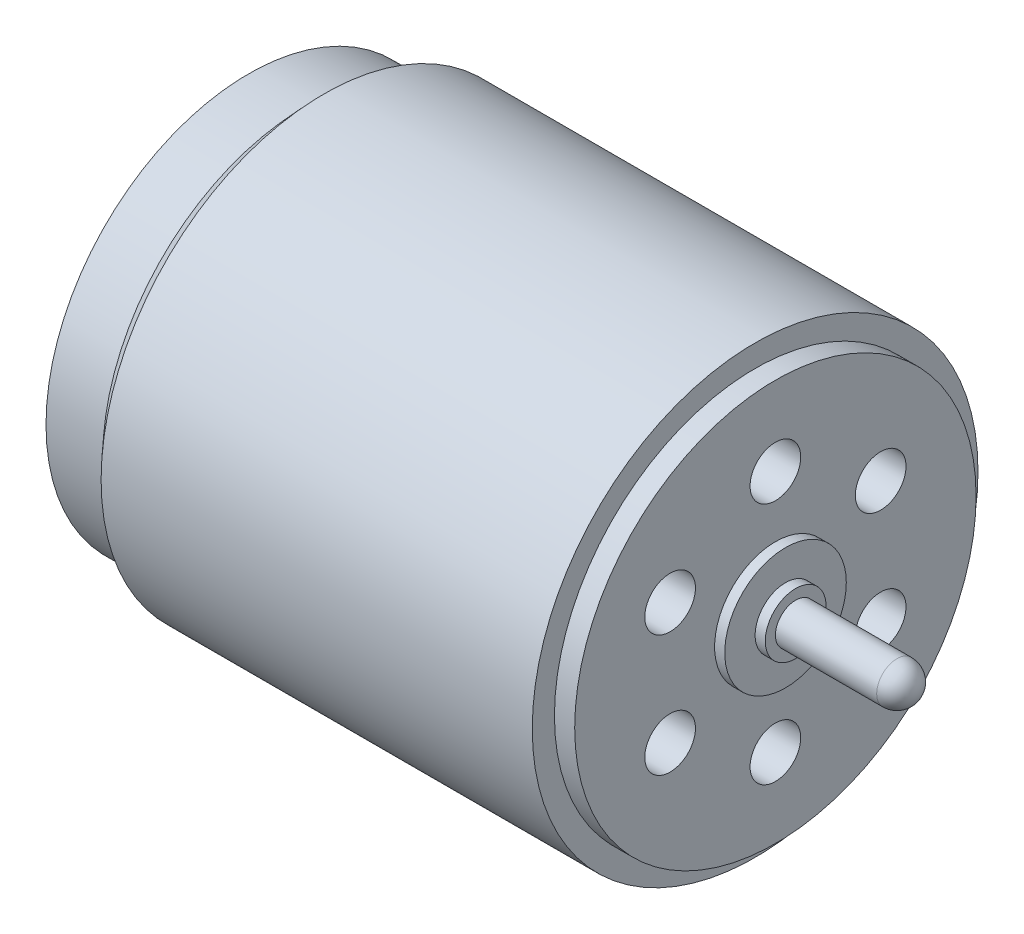
from build123d import *

# Parameters (mm, degrees)
CROQUIS4_R              = 11
SALIENTE_EXTRUIR2_DEPTH = 25
CROQUIS5_R              = 3
SALIENTE_EXTRUIR3_DEPTH = 1.5
CROQUIS6_R              = 1.5
SALIENTE_EXTRUIR4_DEPTH = 0.5
CROQUIS7_R              = 1
SALIENTE_EXTRUIR5_DEPTH = 6
REDONDEO1_R             = 1
CROQUIS10_R             = 9.905946753
SALIENTE_EXTRUIR6_DEPTH = 1
CORTAR_EXTRUIR1_START   = 1
CROQUIS8_R              = 1.25
CORTAR_EXTRUIR1_DEPTH   = 6


with BuildPart() as part:
    # Croquis4 → Saliente-Extruir2 (new body)
    with BuildSketch(Plane(origin=(0, 0, 0), x_dir=(0, 0, -1), z_dir=(1, 0, 0))):
        Circle(CROQUIS4_R)
    extrude(amount=SALIENTE_EXTRUIR2_DEPTH)

    # Croquis5 → Saliente-Extruir3 (add)
    with BuildSketch(Plane(origin=(25, 0, 0), x_dir=(0, 0, -1), z_dir=(1, 0, 0))):
        Circle(CROQUIS5_R)
    extrude(amount=SALIENTE_EXTRUIR3_DEPTH)

    # Croquis6 → Saliente-Extruir4 (add)
    with BuildSketch(Plane(origin=(26.5, 0, 0), x_dir=(0, 0, -1), z_dir=(1, 0, 0))):
        Circle(CROQUIS6_R)
    extrude(amount=SALIENTE_EXTRUIR4_DEPTH)

    # Croquis7 → Saliente-Extruir5 (add)
    with BuildSketch(Plane(origin=(27, 0, 0), x_dir=(0, 0, -1), z_dir=(1, 0, 0))):
        Circle(CROQUIS7_R)
    extrude(amount=SALIENTE_EXTRUIR5_DEPTH)

    # Redondeo1
    redondeo1_edges = [part.edges().sort_by_distance(p)[0] for p in [
        (33, 0, 1),
    ]]
    fillet(redondeo1_edges, radius=REDONDEO1_R)

    # Croquis10 → Saliente-Extruir6 (add)
    with BuildSketch(Plane(origin=(25, 0, 0), x_dir=(0, 0, -1), z_dir=(1, 0, 0))):
        Circle(CROQUIS10_R)
    extrude(amount=SALIENTE_EXTRUIR6_DEPTH)

    # Croquis9 → Cortar-Revolución2 (revolve, cut)
    with BuildSketch(Plane.XY, mode=Mode.PRIVATE) as cortar_revoluci_n2_sk:
        Polygon((3.71935431, 11), (0, 11), (0, 10), (2.798724642, 10), align=None)
    revolve(cortar_revoluci_n2_sk.sketch.rotate(Axis((0, 0, 0), (1, 0, 0)), 90), axis=Axis((0, 0, 0), (1, 0, 0)), mode=Mode.SUBTRACT)

    # Croquis8 → Cortar-Extruir1 (cut)
    with BuildSketch(Plane(origin=(25, 0, 0), x_dir=(0, 0, -1), z_dir=(1, 0, 0)).offset(CORTAR_EXTRUIR1_START)):
        with Locations((0, 6)):
            Circle(CROQUIS8_R)
        with Locations((5.196152423, 3)):
            Circle(CROQUIS8_R)
        with Locations((5.196152423, -3)):
            Circle(CROQUIS8_R)
        with Locations((0, -6)):
            Circle(CROQUIS8_R)
        with Locations((-5.196152423, -3)):
            Circle(CROQUIS8_R)
        with Locations((-5.196152423, 3)):
            Circle(CROQUIS8_R)
    extrude(amount=-CORTAR_EXTRUIR1_DEPTH, mode=Mode.SUBTRACT)


solid = part.part
